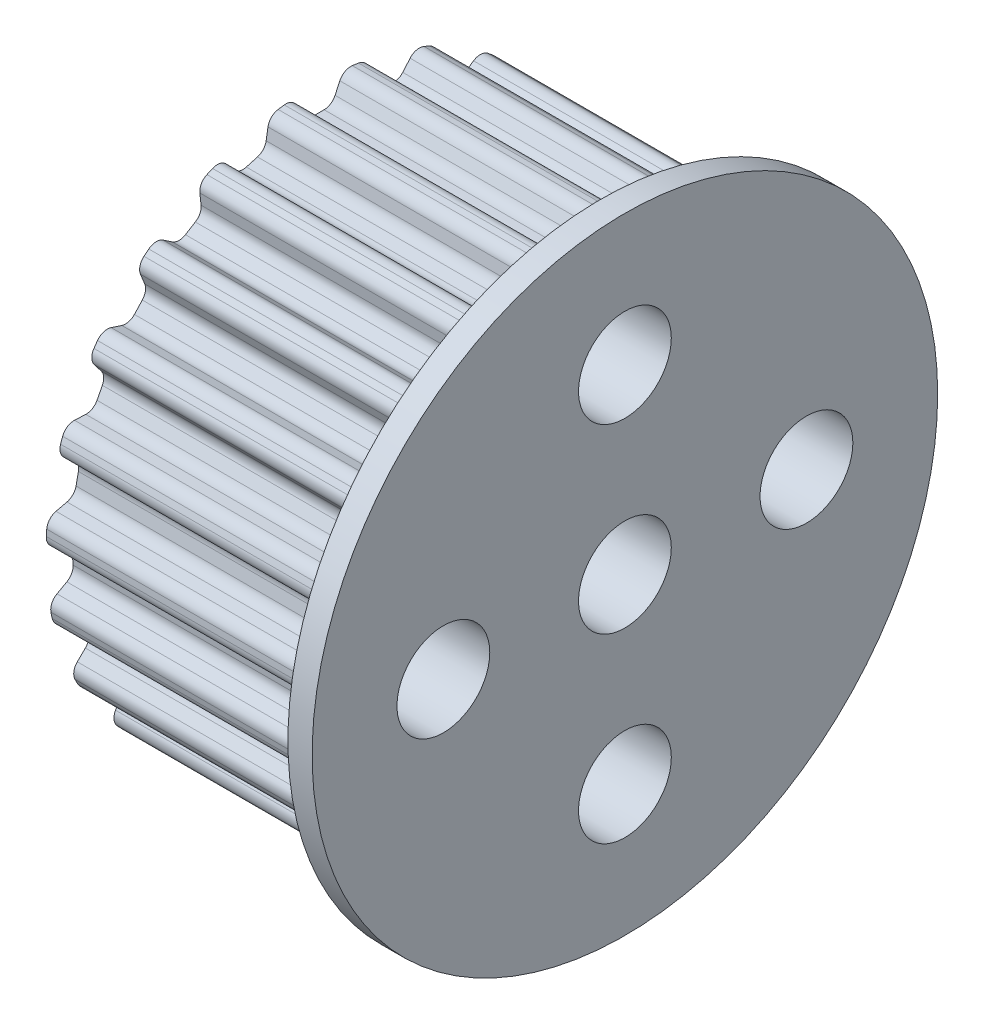
from build123d import *

# Parameters (mm, degrees)
BOSS_EXTRUDE1_DEPTH = 7
CIRPATTERN1_COUNT   = 23
SKETCH2_R           = 1.15
CUT_EXTRUDE1_DEPTH  = 12.834807123
BOSS_EXTRUDE2_START = 0.6
SKETCH3_R           = 7.752907675
SKETCH3_R_2         = 1.15
BOSS_EXTRUDE2_DEPTH = 0.6


with BuildPart() as part:
    # Sketch1 → Boss-Extrude1 (new body)
    with BuildSketch(Plane(origin=(0, 0, 0), x_dir=(0, 0, -1), z_dir=(1, 0, 0))):
        with BuildLine():
            Line((-0.533783114, 6.52919944), (-0.415771258, 6.276122197))
            ThreePointArc((-0.415771258, 6.276122197), (-0.305068804, 6.149890241), (-0.143878922, 6.102907675))
            Line((-0.143878922, 6.102907675), (0.143878922, 6.102907675))
            ThreePointArc((0.143878922, 6.102907675), (0.305068804, 6.149890241), (0.415771258, 6.276122197))
            Line((0.415771258, 6.276122197), (0.533783114, 6.52919944))
            ThreePointArc((0.533783114, 6.52919944), (0.660627393, 6.665018343), (0.843131842, 6.700066475))
            ThreePointArc((0.843131842, 6.700066475), (0.881340667, 6.695147549), (0.91952081, 6.690010729))
            Line((0.91952081, 6.690010729), (0, 0))
            Line((0, 0), (-0.91952081, 6.690010729))
            ThreePointArc((-0.91952081, 6.690010729), (-0.881340667, 6.695147549), (-0.843131842, 6.700066475))
            ThreePointArc((-0.843131842, 6.700066475), (-0.660627393, 6.665018343), (-0.533783114, 6.52919944))
        make_face()
    extrude(amount=BOSS_EXTRUDE1_DEPTH)

    # CirPattern1: part ×23 about axis
    cirpattern1_axis = Axis((0, 0, 0), (1, 0, 0))


with BuildPart() as part_1:
    add(part.part)
    for i in range(1, CIRPATTERN1_COUNT):
        add(part.part.rotate(cirpattern1_axis, i * 360 / CIRPATTERN1_COUNT))

    # Sketch2 → Cut-Extrude1 (cut, through all)
    with BuildSketch(Plane(origin=(7, 0, 0), x_dir=(0, 0, -1), z_dir=(1, 0, 0))):
        Circle(SKETCH2_R)
        with Locations((0, 4.5)):
            Circle(SKETCH2_R)
        with Locations((4.5, 0)):
            Circle(SKETCH2_R)
        with Locations((0, -4.5)):
            Circle(SKETCH2_R)
        with Locations((-4.5, 0)):
            Circle(SKETCH2_R)
    extrude(amount=-CUT_EXTRUDE1_DEPTH, mode=Mode.SUBTRACT)

    # Sketch3 → Boss-Extrude2 (add)
    with BuildSketch(Plane(origin=(7, 0, 0), x_dir=(0, 0, -1), z_dir=(1, 0, 0)).offset(BOSS_EXTRUDE2_START)):
        Circle(SKETCH3_R)
        Circle(SKETCH3_R_2, mode=Mode.SUBTRACT)
        with Locations((-4.5, 0)):
            Circle(SKETCH3_R_2, mode=Mode.SUBTRACT)
        with Locations((0, -4.5)):
            Circle(SKETCH3_R_2, mode=Mode.SUBTRACT)
        with Locations((4.5, 0)):
            Circle(SKETCH3_R_2, mode=Mode.SUBTRACT)
        with Locations((0, 4.5)):
            Circle(SKETCH3_R_2, mode=Mode.SUBTRACT)
    extrude(amount=-BOSS_EXTRUDE2_DEPTH)


solid = part_1.part
